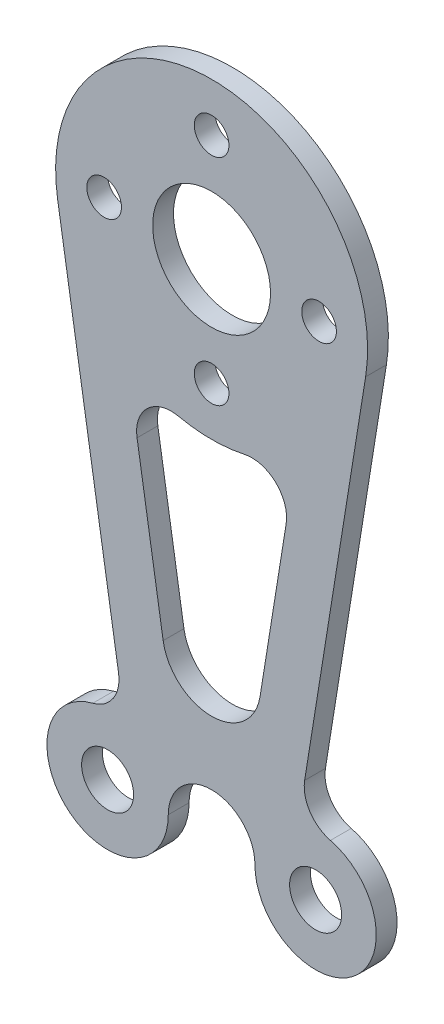
from build123d import *

# Parameters (mm, degrees)
SKETCH1_R           = 3.4
SKETCH1_R_2         = 1
SKETCH1_R_3         = 1.5
BOSS_EXTRUDE1_DEPTH = 1.2
FILLET1_R           = 2


with BuildPart() as part:
    # Sketch1 → Boss-Extrude1 (new body)
    with BuildSketch(Plane.XY):
        with BuildLine():
            Line((8.886327877, -1.425895111), (5, -25.645898034))
            ThreePointArc((5, -25.645898034), (8.80624304, -31.091650066), (2.5, -29))
            ThreePointArc((2.5, -29), (0, -26.5), (-2.5, -29))
            ThreePointArc((-2.5, -29), (-8.80624304, -31.091650066), (-5, -25.645898034))
            Line((-5, -25.645898034), (-8.886327877, -1.425895111))
            ThreePointArc((-8.886327877, -1.425895111), (0, 9), (8.886327877, -1.425895111))
        make_face()
        Circle(SKETCH1_R, mode=Mode.SUBTRACT)
        with Locations((0, 6.2)):
            Circle(SKETCH1_R_2, mode=Mode.SUBTRACT)
        with Locations((6.2, 0)):
            Circle(SKETCH1_R_2, mode=Mode.SUBTRACT)
        with Locations((0, -6.2)):
            Circle(SKETCH1_R_2, mode=Mode.SUBTRACT)
        with Locations((-6.2, 0)):
            Circle(SKETCH1_R_2, mode=Mode.SUBTRACT)
        with Locations((6, -29)):
            Circle(SKETCH1_R_3, mode=Mode.SUBTRACT)
        with Locations(Location((-6, -29, 0), (0, 0, 180))):
            Circle(SKETCH1_R_3, mode=Mode.SUBTRACT)
        with BuildLine():
            Line((4.861419119, -7.574074475), (2.795583653, -20.448577761))
            ThreePointArc((2.795583653, -20.448577761), (0, -22.831344198), (-2.795583653, -20.448577761))
            Line((-2.795583653, -20.448577761), (-4.861419119, -7.574074475))
            ThreePointArc((-4.861419119, -7.574074475), (0, -9), (4.861419119, -7.574074475))
        make_face(mode=Mode.SUBTRACT)
    extrude(amount=BOSS_EXTRUDE1_DEPTH)

    # Fillet1
    fillet1_edges = [part.edges().sort_by_distance(p)[0] for p in [
        (5, -25.645898034, 0.6),
        (-5, -25.645898034, 0.6),
        (4.861419119, -7.574074475, 0.6),
        (-4.861419119, -7.574074475, 0.6),
    ]]
    fillet(fillet1_edges, radius=FILLET1_R)


solid = part.part
